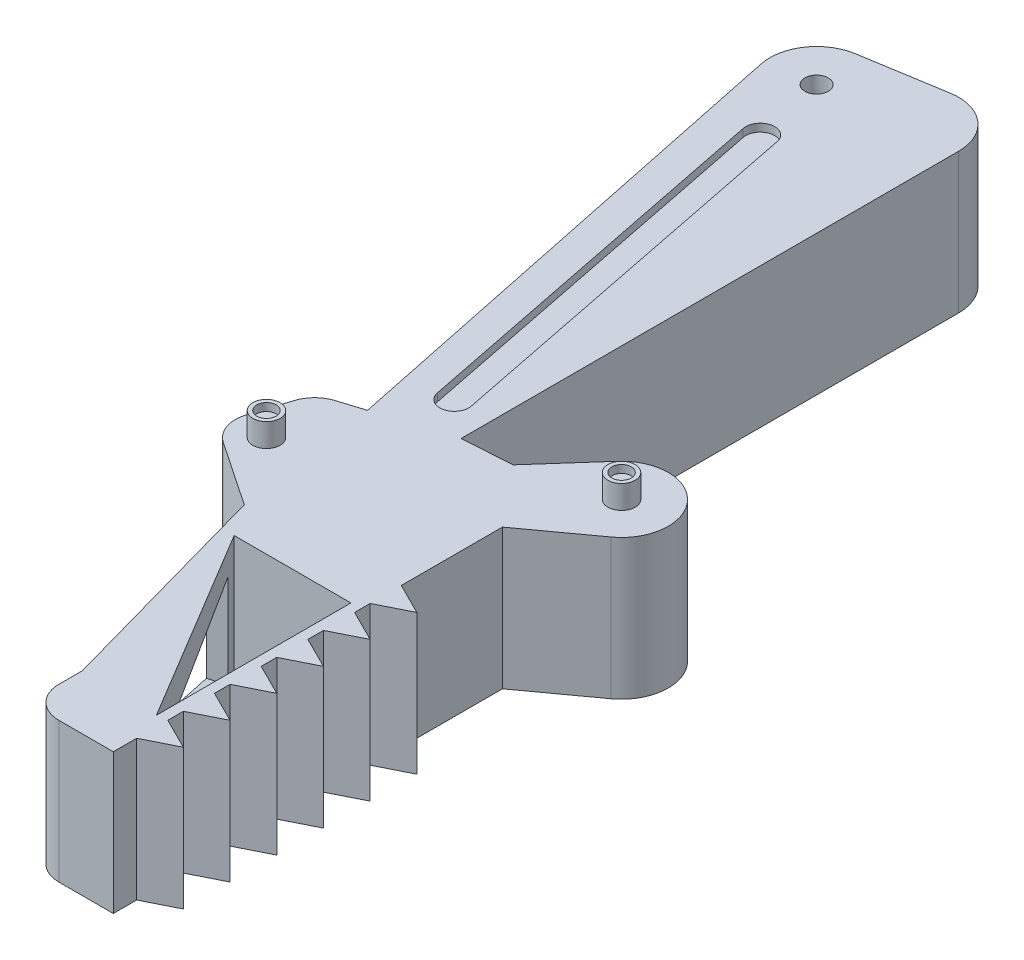
from build123d import *

# Parameters (mm, degrees)
BOSS_EXTRUDE1_DEPTH = 9
FILLET1_R           = 6
FILLET2_R           = 4
BOSS_EXTRUDE2_DEPTH = 18
LPATTERN1_COUNT     = 6
LPATTERN1_PITCH     = 6
CUT_EXTRUDE1_DEPTH  = 26
CUT_EXTRUDE2_DEPTH  = 8
SKETCH7_R           = 1.5
CUT_EXTRUDE3_DEPTH  = 26
SKETCH8_R           = 1.75
BOSS_EXTRUDE3_DEPTH = 3
SKETCH9_R           = 1.25
CUT_EXTRUDE4_DEPTH  = 1
SKETCH10_R          = 1.25
CUT_EXTRUDE5_DEPTH  = 1
CUT_EXTRUDE6_DEPTH  = 1


with BuildPart() as part:
    # Sketch2 → Boss-Extrude1 (new, symmetric)
    with BuildSketch(Plane(origin=(0, 0, 0), x_dir=(1, 0, 0), z_dir=(0, 1, 0))):
        with BuildLine():
            ThreePointArc((9.952664911, -63.474262908), (18.884876985, -63.429469216), (17.963436499, -72.314139521))
            Line((17.963436499, -72.314139521), (9.870678178, -78.188427797))
            Line((9.870678178, -78.188427797), (9.870678178, -128.188427797))
            Line((9.870678178, -128.188427797), (-1.129321822, -128.188427797))
            Line((-1.129321822, -128.188427797), (-1.129321822, -121.188427797))
            Line((-1.129321822, -121.188427797), (-9.195214577, -92.293075678))
            Line((-9.195214577, -92.293075678), (-19.97492157, -85.026858152))
            Line((-19.97492157, -85.026858152), (-16.951577323, -75.494838976))
            Line((-16.951577323, -75.494838976), (-11.784410902, -73.871887989))
            Line((-11.784410902, -73.871887989), (-2.640867258, -71))
            Line((-2.640867258, -71), (3.643526088, -70.578297923))
            Line((3.643526088, -70.578297923), (9.952664911, -63.474262908))
        make_face()
        Polygon((-11.784410902, -73.871887989), (-26.326484906, -3.871887989), (-2.640867258, 0), (-2.640867258, -71), align=None)
    extrude(amount=BOSS_EXTRUDE1_DEPTH, both=True)

    # Fillet1
    fillet1_edges = [part.edges().sort_by_distance(p)[0] for p in [
        (-26.326484906, 0, 3.871887989),
        (-2.640867258, 0, 0),
    ]]
    fillet(fillet1_edges, radius=FILLET1_R)

    # Fillet2
    fillet2_edges = [part.edges().sort_by_distance(p)[0] for p in [
        (-1.129321822, 0, 128.188427797),
        (-19.97492157, 0, 85.026858152),
        (-16.951577323, 0, 75.494838976),
    ]]
    fillet(fillet2_edges, radius=FILLET2_R)

    # Sketch3 → Boss-Extrude2 (add)
    with BuildSketch(Plane(origin=(0, 9, 0), x_dir=(1, 0, 0), z_dir=(0, 1, 0))):
        Polygon((9.870678178, -125.188427797), (9.870678178, -121.188427797), (13.870678178, -123.188427797), align=None)
    boss_extrude2 = extrude(amount=-BOSS_EXTRUDE2_DEPTH)

    # LPattern1: Boss-Extrude2 ×6
    with Locations(*[(0, 0, -i * LPATTERN1_PITCH) for i in range(1, LPATTERN1_COUNT)]):
        add(boss_extrude2)

    # Sketch5 → Cut-Extrude1 (cut)
    with BuildSketch(Plane(origin=(0, 9, 0), x_dir=(1, 0, 0), z_dir=(0, 1, 0))):
        Polygon((8.581909731, -96.366546328), (-6.418090269, -96.366546328), (8.581909731, -121.366546328), align=None)
    extrude(amount=-CUT_EXTRUDE1_DEPTH, mode=Mode.SUBTRACT)

    # Sketch6 → Cut-Extrude2 (cut)
    with BuildSketch(Plane(origin=(-32.431019942, 0, 9.052844475), x_dir=(0.2688630918299989, 0, 0.9631784039582769), z_dir=(-0.963178403958277, 0, 0.2688630918299989))):
        Polygon((93.422443507, 6), (93.422443507, -6), (111.422443507, -4.533928271), (111.422443507, 4.533928271), align=None)
    extrude(amount=-CUT_EXTRUDE2_DEPTH, mode=Mode.SUBTRACT)

    # Sketch7 → Cut-Extrude3 (cut)
    with BuildSketch(Plane(origin=(0, 9, 0), x_dir=(1, 0, 0), z_dir=(0, 1, 0))):
        with Locations(Location((-19.178129346, -8.782985081, 0), (0, 0, 270))):
            Circle(SKETCH7_R)
    extrude(amount=-CUT_EXTRUDE3_DEPTH, mode=Mode.SUBTRACT)

    # Sketch8 → Boss-Extrude3 (add)
    with BuildSketch(Plane(origin=(0, 9, 0), x_dir=(1, 0, 0), z_dir=(0, 1, 0))):
        with Locations(Location((14.438863534, -67.458484528, 0), (0, 0, 270))):
            Circle(SKETCH8_R)
        with Locations(Location((-15.257160901, -83.38305422, 0), (0, 0, 270))):
            Circle(SKETCH8_R)
    boss_extrude3 = extrude(amount=BOSS_EXTRUDE3_DEPTH)

    # Sketch9 → Cut-Extrude4 (cut)
    with BuildSketch(Plane(origin=(0, 12, 0), x_dir=(1, 0, 0), z_dir=(0, 1, 0))):
        with Locations(Location((-15.257160901, -83.38305422, 0), (0, 0, 270))):
            Circle(SKETCH9_R)
    cut_extrude4 = extrude(amount=-CUT_EXTRUDE4_DEPTH, mode=Mode.SUBTRACT)

    # Sketch10 → Cut-Extrude5 (cut)
    with BuildSketch(Plane(origin=(0, 12, 0), x_dir=(1, 0, 0), z_dir=(0, 1, 0))):
        with Locations(Location((14.438863534, -67.458484528, 0), (0, 0, 270))):
            Circle(SKETCH10_R)
    cut_extrude5 = extrude(amount=-CUT_EXTRUDE5_DEPTH, mode=Mode.SUBTRACT)

    # Sketch11 → Cut-Extrude6 (cut)
    with BuildSketch(Plane(origin=(0, 9, 0), x_dir=(1, 0, 0), z_dir=(0, 1, 0))):
        with BuildLine():
            Line((-15.375345178, -17.642535787), (-5.588816332, -66.731764476))
            ThreePointArc((-5.588816332, -66.731764476), (-7.046968284, -68.91608772), (-9.231291528, -67.457935767))
            Line((-9.231291528, -67.457935767), (-19.017820373, -18.368707078))
            ThreePointArc((-19.017820373, -18.368707078), (-17.559668421, -16.184383835), (-15.375345178, -17.642535787))
        make_face()
    cut_extrude6 = extrude(amount=-CUT_EXTRUDE6_DEPTH, mode=Mode.SUBTRACT)

    # Mirror1: Boss-Extrude3, Cut-Extrude4, Cut-Extrude5, Cut-Extrude6 across plane
    add(boss_extrude3.mirror(Plane.ZX))
    add(cut_extrude4.mirror(Plane.ZX), mode=Mode.SUBTRACT)
    add(cut_extrude5.mirror(Plane.ZX), mode=Mode.SUBTRACT)
    add(cut_extrude6.mirror(Plane.ZX), mode=Mode.SUBTRACT)


solid = part.part
